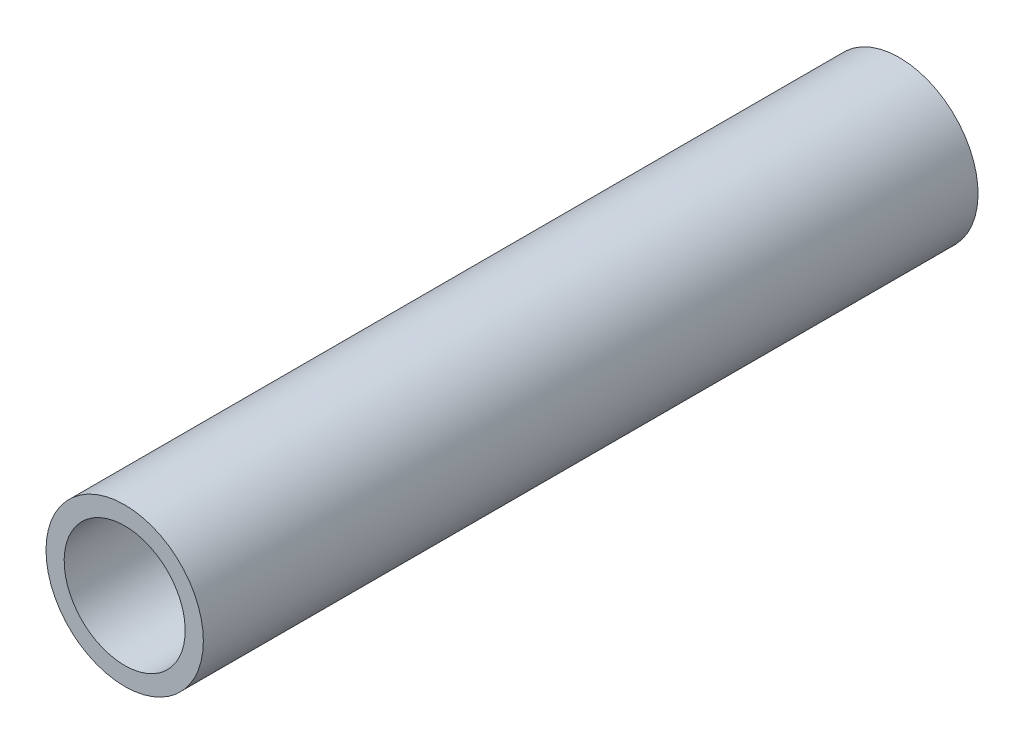
from build123d import *

# Parameters (mm, degrees)
EXTRUDE1_DEPTH                  = 19.2
EXTRUDE1_DEPTH_BACK             = 19.2
SKETCH1_R                       = 3.9
M6X1_0_TAPPED_HOLE3_D           = 5
M6X1_0_TAPPED_HOLE3_DEPTH       = 15
M6X1_0_TAPPED_HOLE3_CBORE_D     = 6
M6X1_0_TAPPED_HOLE3_CBORE_DEPTH = 12
M6X1_0_TAPPED_HOLE3_TIP         = 1.502151548
M6X1_0_TAPPED_HOLE4_D           = 5
M6X1_0_TAPPED_HOLE4_DEPTH       = 15
M6X1_0_TAPPED_HOLE4_CBORE_D     = 6
M6X1_0_TAPPED_HOLE4_CBORE_DEPTH = 12
M6X1_0_TAPPED_HOLE4_TIP         = 1.502151548


with BuildPart() as part:
    # Sketch1 → Extrude1 (new, two sides: drawn at the far end of the back side and taken through both)
    with BuildSketch(Plane.XY.offset(-EXTRUDE1_DEPTH_BACK)):
        with Locations(Location((12.965088215, 18.997538987, 0), (0, 0, 90))):
            Circle(SKETCH1_R)
    extrude(amount=EXTRUDE1_DEPTH + EXTRUDE1_DEPTH_BACK)

    # M6x1.0 Tapped Hole3
    with Locations(Plane(origin=(12.965088215, 18.997538987, 19.2), x_dir=(0, 1, 0), z_dir=(0, 0, 1))):
        with Locations((0, 0)):
            CounterBoreHole(M6X1_0_TAPPED_HOLE3_D / 2, M6X1_0_TAPPED_HOLE3_CBORE_D / 2, M6X1_0_TAPPED_HOLE3_CBORE_DEPTH, depth=M6X1_0_TAPPED_HOLE3_DEPTH)
            with Locations((0, 0, -(M6X1_0_TAPPED_HOLE3_DEPTH + M6X1_0_TAPPED_HOLE3_TIP / 2))):  # 118° drill point
                Cone(0, M6X1_0_TAPPED_HOLE3_D / 2, M6X1_0_TAPPED_HOLE3_TIP, mode=Mode.SUBTRACT)

    # M6x1.0 Tapped Hole4
    with Locations(Plane(origin=(12.965088215, 18.997538987, -19.2), x_dir=(0, -1, 0), z_dir=(0, 0, -1))):
        with Locations((0, 0)):
            CounterBoreHole(M6X1_0_TAPPED_HOLE4_D / 2, M6X1_0_TAPPED_HOLE4_CBORE_D / 2, M6X1_0_TAPPED_HOLE4_CBORE_DEPTH, depth=M6X1_0_TAPPED_HOLE4_DEPTH)
            with Locations((0, 0, -(M6X1_0_TAPPED_HOLE4_DEPTH + M6X1_0_TAPPED_HOLE4_TIP / 2))):  # 118° drill point
                Cone(0, M6X1_0_TAPPED_HOLE4_D / 2, M6X1_0_TAPPED_HOLE4_TIP, mode=Mode.SUBTRACT)


solid = part.part
